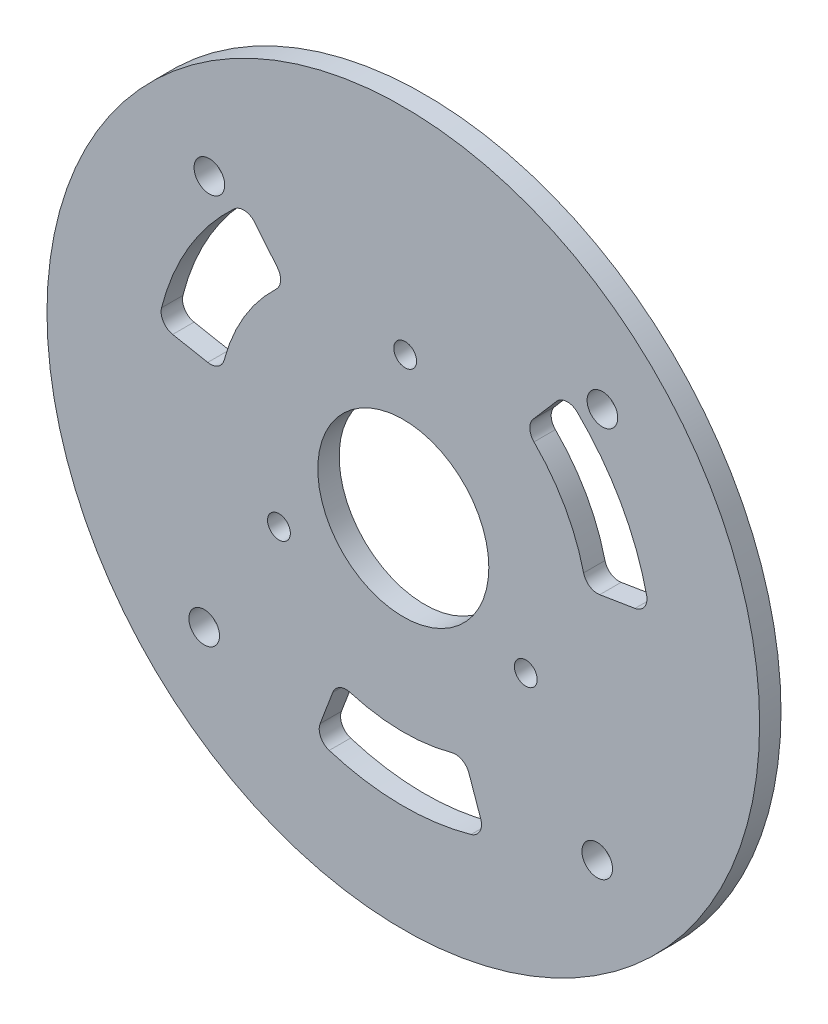
from build123d import *

# Parameters (mm, degrees)
SKETCH_1_R                       = 50
SKETCH_1_R_2                     = 12
EXTRUDE_1_DEPTH                  = 3
SKETCH_2_R                       = 1.6
CUT_EXTRUDE_1_DEPTH              = 71.774289117
CUT_EXTRUDE_3_DEPTH              = 71.774289117
FILLET_1_R                       = 2
PATTERN_CIRCULAR_2_COUNT         = 3
FILLET_1_OF_PATTERN_CIRCULAR_2_R = 2
SKETCH_5_R                       = 2.15
CUT_EXTRUDE_4_DEPTH              = 10


with BuildPart() as part:
    # 草图1 → 凸台-拉伸1 (new body)
    with BuildSketch(Plane.XY):
        Circle(SKETCH_1_R)
        Circle(SKETCH_1_R_2, mode=Mode.SUBTRACT)
    extrude(amount=EXTRUDE_1_DEPTH)

    # 草图2 → 切除-拉伸1 (cut, through all)
    with BuildSketch(Plane.XY.offset(3)):
        with Locations((0.263678953, 19.99826176)):
            Circle(SKETCH_2_R)
        with Locations((17.187163239, -10.227483551)):
            Circle(SKETCH_2_R)
        with Locations((-17.450842192, -9.770778208)):
            Circle(SKETCH_2_R)
    extrude(amount=-CUT_EXTRUDE_1_DEPTH, mode=Mode.SUBTRACT)

    # 草图4 → 切除-拉伸3 (cut, through all)
    with BuildSketch(Plane(origin=(0, 0, 0), x_dir=(-1, 0, 0), z_dir=(0, 0, -1))):
        with BuildLine():
            Line((16.448438601, 20.135760914), (22.142128886, 27.105831999))
            ThreePointArc((22.142128886, 27.105831999), (30.077535668, 17.898096215), (34.385147752, 6.531585879))
            Line((34.385147752, 6.531585879), (25.543252616, 4.852035224))
            ThreePointArc((25.543252616, 4.852035224), (22.343312211, 13.295728617), (16.448438601, 20.135760914))
        make_face()
    cut_extrude_3 = extrude(amount=-CUT_EXTRUDE_3_DEPTH, mode=Mode.SUBTRACT)

    # 圆角1
    fillet_1_edges = [part.edges().sort_by_distance(p)[0] for p in [
        (-25.543252616, 4.852035224, 1.5),
        (-16.448438601, 20.135760914, 1.5),
        (-22.142128886, 27.105831999, 1.5),
        (-34.385147752, 6.531585879, 1.5),
    ]]
    fillet(fillet_1_edges, radius=FILLET_1_R)

    # 阵列(圆周)2: 切除-拉伸3 ×3 about axis
    pattern_circular_2_axis = Axis((0, 0, 0), (0, 0, 1))
    for i in range(1, PATTERN_CIRCULAR_2_COUNT):
        add(cut_extrude_3.rotate(pattern_circular_2_axis, i * 360 / PATTERN_CIRCULAR_2_COUNT), mode=Mode.SUBTRACT)

    # 圆角1 of 阵列(圆周)2
    fillet_1_of_pattern_circular_2_edges = [part.edges().sort_by_distance(p)[0] for p in [
        (8.569640543, -24.547123273, 1.5),
        (-9.213861175, -24.312646138, 1.5),
        (-12.403274659, -32.728562109, 1.5),
        (11.536054578, -33.044204405, 1.5),
        (16.973612072, 19.695088048, 1.5),
        (25.662299777, 4.176885224, 1.5),
        (34.545403545, 5.62273011, 1.5),
        (22.849093174, 26.512618526, 1.5),
    ]]
    fillet(fillet_1_of_pattern_circular_2_edges, radius=FILLET_1_OF_PATTERN_CIRCULAR_2_R)

    # 草图5 → 切除-拉伸4 (cut)
    with BuildSketch(Plane.XY):
        with Locations((27.938343572, 27.211191787)):
            Circle(SKETCH_5_R)
        with Locations((27.211191787, -27.938343572)):
            Circle(SKETCH_5_R)
        with Locations((-27.938343572, -27.211191787)):
            Circle(SKETCH_5_R)
        with Locations((-27.211191787, 27.938343572)):
            Circle(SKETCH_5_R)
    extrude(amount=CUT_EXTRUDE_4_DEPTH, mode=Mode.SUBTRACT)


solid = part.part
